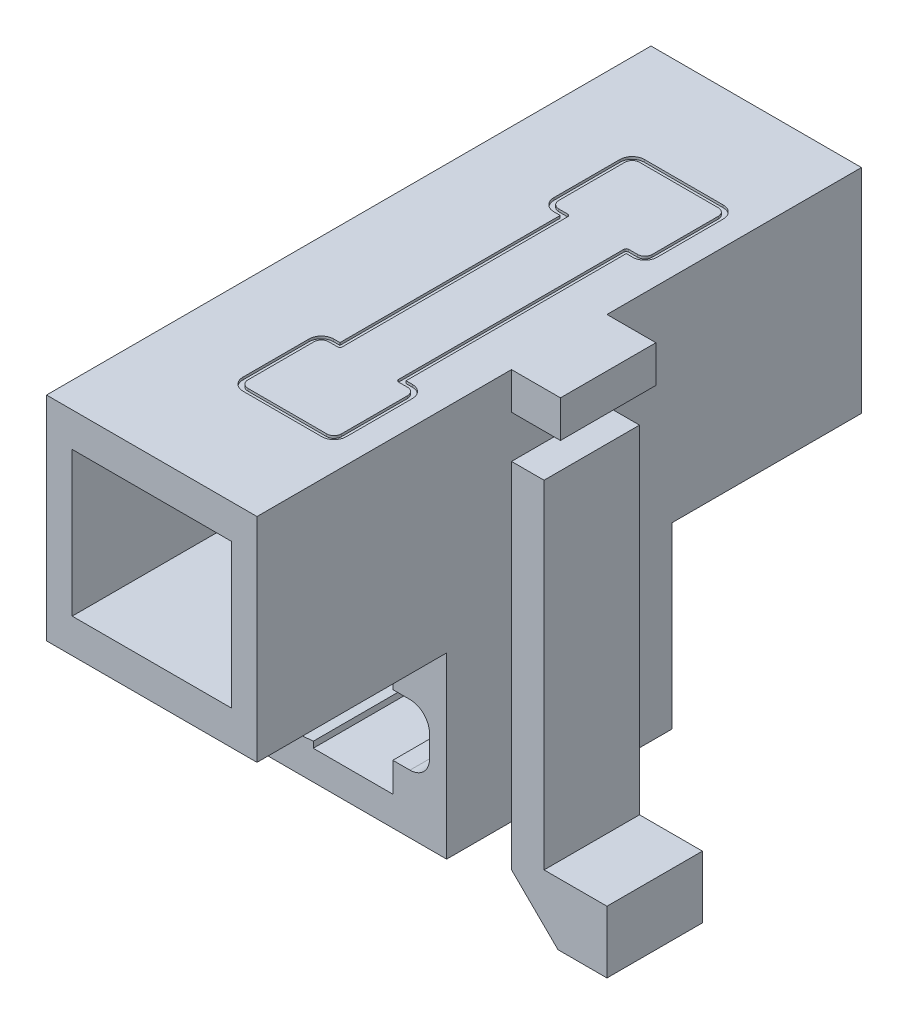
from build123d import *

# Parameters (mm, degrees)
SKETCH1_W                = 8.6
SKETCH1_H                = 8.7
SKETCH1_W_2              = 6.5
SKETCH1_H_2              = 5.9
BOSS_EXTRUDE1_DEPTH      = 24.7
BOSS_EXTRUDE2_DEPTH      = 1.95
BOSS_EXTRUDE2_DEPTH_BACK = 1.95
SKETCH2_W                = 2
SKETCH2_H                = 1.51
BOSS_EXTRUDE3_DEPTH      = 4.6
BOSS_EXTRUDE3_DEPTH_BACK = 4.6
CUT_EXTRUDE1_DEPTH       = 0.1


with BuildPart() as part:
    # Sketch1 → Boss-Extrude1 (new body)
    with BuildSketch(Plane.XY):
        Rectangle(SKETCH1_W, SKETCH1_H)
        Rectangle(SKETCH1_W_2, SKETCH1_H_2, mode=Mode.SUBTRACT)
    extrude(amount=BOSS_EXTRUDE1_DEPTH)

    # Sketch2 → Boss-Extrude2 (add, two sides: drawn at the far end of the back side and taken through both)
    with BuildSketch(Plane.XY.offset(12.35).offset(-BOSS_EXTRUDE2_DEPTH_BACK)):
        with Locations((5.3, 3.595)):
            Rectangle(SKETCH2_W, SKETCH2_H)
        Polygon((4.3, 1.1), (5.63, 1.1), (5.63, -12.69), (8.2, -12.69), (8.2, -15.23), (6.2, -15.23), (4.3, -13.35), align=None)
    extrude(amount=BOSS_EXTRUDE2_DEPTH + BOSS_EXTRUDE2_DEPTH_BACK)

    # Sketch3 → Boss-Extrude3 (add, two sides: drawn at the far end of the back side and taken through both)
    with BuildSketch(Plane.XY.offset(12.35).offset(-BOSS_EXTRUDE3_DEPTH_BACK)):
        with BuildLine():
            Line((4.3, -4.35), (-4.3, -4.35))
            Line((-4.3, -4.35), (-4.3, -5.55))
            Line((-4.3, -5.55), (-1.15, -5.8))
            Line((-1.15, -5.8), (-1.15, -5.55))
            Line((-1.15, -5.55), (2.1, -5.55))
            Line((2.1, -5.55), (2.1, -6.75))
            Line((2.1, -6.75), (2.8, -6.75))
            ThreePointArc((2.8, -6.75), (3.365685425, -6.984314575), (3.6, -7.55))
            Line((3.6, -7.55), (3.6, -8.45))
            ThreePointArc((3.6, -8.45), (3.365685425, -9.015685425), (2.8, -9.25))
            Line((2.8, -9.25), (2.1, -9.25))
            Line((2.1, -9.25), (2.1, -10.45))
            Line((2.1, -10.45), (-1.15, -10.45))
            Line((-1.15, -10.45), (-1.15, -10.2))
            Line((-1.15, -10.2), (-4.3, -10.45))
            Line((-4.3, -10.45), (-4.3, -11.65))
            Line((-4.3, -11.65), (4.3, -11.65))
            Line((4.3, -11.65), (4.3, -4.35))
        make_face()
    extrude(amount=BOSS_EXTRUDE3_DEPTH + BOSS_EXTRUDE3_DEPTH_BACK)

    # Sketch4 → Cut-Extrude1 (cut)
    with BuildSketch(Plane(origin=(0, 4.35, 0), x_dir=(1, 0, 0), z_dir=(0, 1, 0))):
        with BuildLine():
            Line((-0.16, -12.35), (-0.16, -16.85))
            Line((-0.16, -16.85), (-0.42, -16.85))
            ThreePointArc((-0.42, -16.85), (-0.773553391, -16.996446609), (-0.92, -17.35))
            Line((-0.92, -17.35), (-0.92, -20.05))
            ThreePointArc((-0.92, -20.05), (-0.773553391, -20.403553391), (-0.42, -20.55))
            Line((-0.42, -20.55), (2.8, -20.55))
            ThreePointArc((2.8, -20.55), (3.153553391, -20.403553391), (3.3, -20.05))
            Line((3.3, -20.05), (3.3, -17.35))
            ThreePointArc((3.3, -17.35), (3.153553391, -16.996446609), (2.8, -16.85))
            Line((2.8, -16.85), (2.54, -16.85))
            Line((2.54, -16.85), (2.54, -12.35))
            Line((2.54, -12.35), (2.54, -7.85))
            Line((2.54, -7.85), (2.8, -7.85))
            ThreePointArc((2.8, -7.85), (3.153553391, -7.703553391), (3.3, -7.35))
            Line((3.3, -7.35), (3.3, -4.65))
            ThreePointArc((3.3, -4.65), (3.153553391, -4.296446609), (2.8, -4.15))
            Line((2.8, -4.15), (-0.42, -4.15))
            ThreePointArc((-0.42, -4.15), (-0.773553391, -4.296446609), (-0.92, -4.65))
            Line((-0.92, -4.65), (-0.92, -7.35))
            ThreePointArc((-0.92, -7.35), (-0.773553391, -7.703553391), (-0.42, -7.85))
            Line((-0.42, -7.85), (-0.16, -7.85))
            Line((-0.16, -7.85), (-0.16, -12.35))
        make_face()
        with BuildLine():
            Line((2.34, -16.95), (2.34, -7.75))
            ThreePointArc((2.34, -7.75), (2.369289322, -7.679289322), (2.44, -7.65))
            Line((2.44, -7.65), (2.8, -7.65))
            ThreePointArc((2.8, -7.65), (3.012132034, -7.562132034), (3.1, -7.35))
            Line((3.1, -7.35), (3.1, -4.65))
            ThreePointArc((3.1, -4.65), (3.012132034, -4.437867966), (2.8, -4.35))
            Line((2.8, -4.35), (-0.42, -4.35))
            ThreePointArc((-0.42, -4.35), (-0.632132034, -4.437867966), (-0.72, -4.65))
            Line((-0.72, -4.65), (-0.72, -7.35))
            ThreePointArc((-0.72, -7.35), (-0.632132034, -7.562132034), (-0.42, -7.65))
            Line((-0.42, -7.65), (-0.06, -7.65))
            ThreePointArc((-0.06, -7.65), (0.010710678, -7.679289322), (0.04, -7.75))
            Line((0.04, -7.75), (0.04, -16.95))
            ThreePointArc((0.04, -16.95), (0.010710678, -17.020710678), (-0.06, -17.05))
            Line((-0.06, -17.05), (-0.42, -17.05))
            ThreePointArc((-0.42, -17.05), (-0.632132034, -17.137867966), (-0.72, -17.35))
            Line((-0.72, -17.35), (-0.72, -20.05))
            ThreePointArc((-0.72, -20.05), (-0.632132034, -20.262132034), (-0.42, -20.35))
            Line((-0.42, -20.35), (2.8, -20.35))
            ThreePointArc((2.8, -20.35), (3.012132034, -20.262132034), (3.1, -20.05))
            Line((3.1, -20.05), (3.1, -17.35))
            ThreePointArc((3.1, -17.35), (3.012132034, -17.137867966), (2.8, -17.05))
            Line((2.8, -17.05), (2.44, -17.05))
            ThreePointArc((2.44, -17.05), (2.369289322, -17.020710678), (2.34, -16.95))
        make_face(mode=Mode.SUBTRACT)
    extrude(amount=-CUT_EXTRUDE1_DEPTH, mode=Mode.SUBTRACT)


solid = part.part
